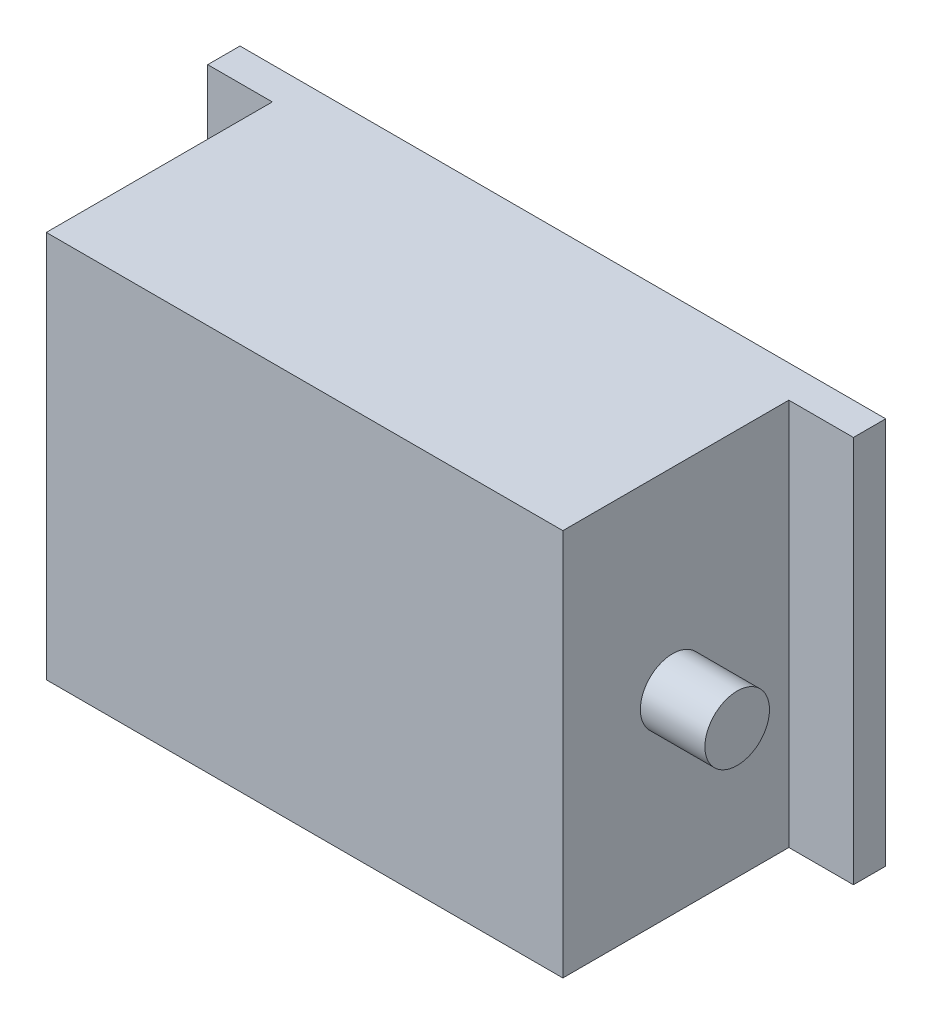
from build123d import *

# Parameters (mm, degrees)
SKETCH1_W           = 100
SKETCH1_H           = 60
BOSS_EXTRUDE1_DEPTH = 40
SKETCH2_W           = 10
SKETCH2_H           = 35
CUT_EXTRUDE1_DEPTH  = 124.288280059
SKETCH3_R           = 10
CUT_EXTRUDE2_DEPTH  = 10
SKETCH4_R           = 5
BOSS_EXTRUDE2_DEPTH = 10


with BuildPart() as part:
    # Sketch1 → Boss-Extrude1 (new body)
    with BuildSketch(Plane.XY):
        with Locations((50, 30)):
            Rectangle(SKETCH1_W, SKETCH1_H)
    extrude(amount=BOSS_EXTRUDE1_DEPTH)

    # Sketch2 → Cut-Extrude1 (cut, through all)
    with BuildSketch(Plane.XZ):
        with Locations((5, 22.5)):
            Rectangle(SKETCH2_W, SKETCH2_H)
        with Locations((95, 22.5)):
            Rectangle(SKETCH2_W, SKETCH2_H)
    extrude(amount=-CUT_EXTRUDE1_DEPTH, mode=Mode.SUBTRACT)

    # Sketch3 → Cut-Extrude2 (cut)
    with BuildSketch(Plane.ZY.offset(-10)):
        with Locations((20, 30)):
            Circle(SKETCH3_R)
    extrude(amount=-CUT_EXTRUDE2_DEPTH, mode=Mode.SUBTRACT)

    # Sketch4 → Boss-Extrude2 (add)
    with BuildSketch(Plane(origin=(90, 0, 0), x_dir=(0, 0, -1), z_dir=(1, 0, 0))):
        with Locations(Location((-23, 30, 0), (0, 0, 180))):
            Circle(SKETCH4_R)
    extrude(amount=BOSS_EXTRUDE2_DEPTH)


solid = part.part
